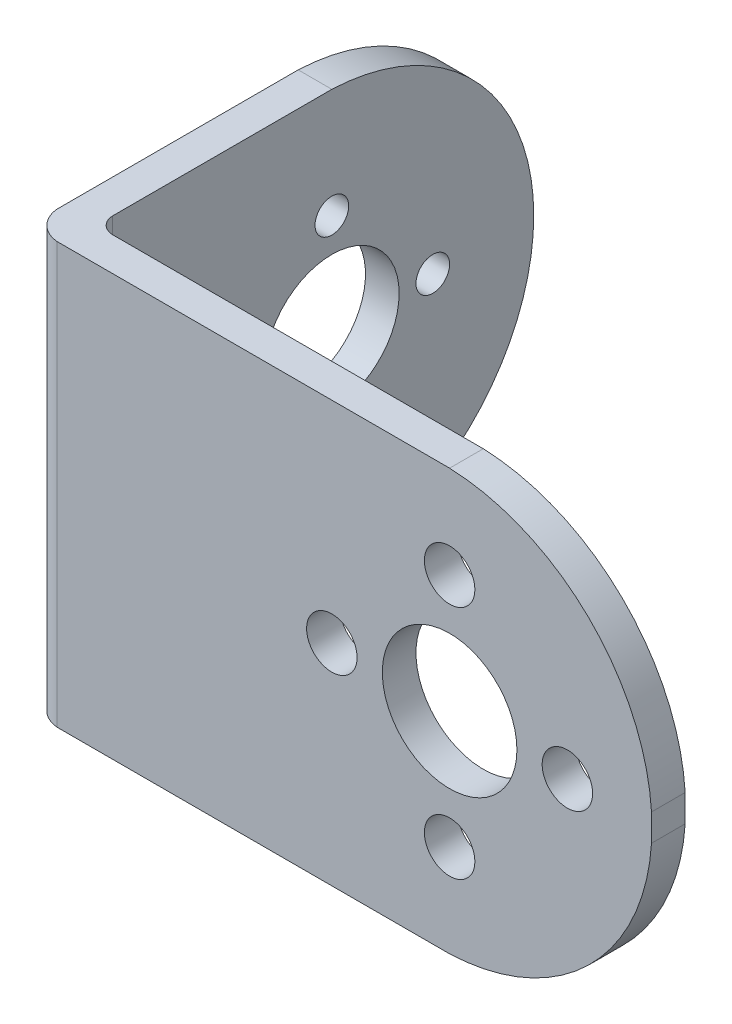
from build123d import *

# Parameters (mm, degrees)
BOSS_EXTRUDE1_DEPTH = 25
CUT_EXTRUDE1_DEPTH  = 25
CUT_EXTRUDE2_DEPTH  = 25
SKETCH5_R           = 4
SKETCH5_R_2         = 1.5
CUT_EXTRUDE3_DEPTH  = 25
SKETCH6_R           = 4
SKETCH6_R_2         = 1
CUT_EXTRUDE4_DEPTH  = 25


with BuildPart() as part:
    # Sketch1 → Boss-Extrude1 (new body)
    with BuildSketch(Plane(origin=(0, 0, 0), x_dir=(1, 0, 0), z_dir=(0, 1, 0))):
        with BuildLine():
            ThreePointArc((0, 1.659075407), (0.530256055, 0.530256055), (1.659075407, 0))
            Line((1.659075407, 0), (2, 0))
            Line((2, 0), (37, 0))
            Line((37, 0), (37, 2))
            Line((37, 2), (3.038729714, 2))
            ThreePointArc((3.038729714, 2), (3.003147911, 1.999369152), (2.967566108, 2))
            ThreePointArc((2.967566108, 2), (2.293369144, 2.293369144), (2, 2.967566108))
            Line((2, 2.967566108), (2, 28))
            Line((2, 28), (0, 28))
            Line((0, 28), (0, 2))
            Line((0, 2), (0, 1.659075407))
        make_face()
    extrude(amount=BOSS_EXTRUDE1_DEPTH)

    # Sketch2 → Cut-Extrude1 (cut)
    with BuildSketch(Plane.ZY):
        with BuildLine():
            ThreePointArc((-28, 12.5), (-24.514439297, 21.163861726), (-16, 25))
            Line((-16, 25), (-28, 25))
            Line((-28, 25), (-28, 12.5))
        make_face()
        with BuildLine():
            ThreePointArc((-16, 0), (-24.514439297, 3.836138274), (-28, 12.5))
            Line((-28, 12.5), (-28, 0))
            Line((-28, 0), (-16, 0))
        make_face()
    extrude(amount=-CUT_EXTRUDE1_DEPTH, mode=Mode.SUBTRACT)

    # Sketch4 → Cut-Extrude2 (cut)
    with BuildSketch(Plane.XY):
        with BuildLine():
            Line((37, 25), (25, 25))
            ThreePointArc((25, 25), (33.247279652, 21.458751494), (37, 13.305521912))
            Line((37, 13.305521912), (37, 25))
        make_face()
        with BuildLine():
            Line((37, 0), (37, 11.694478088))
            ThreePointArc((37, 11.694478088), (33.247279652, 3.541248506), (25, 0))
            Line((25, 0), (37, 0))
        make_face()
    extrude(amount=-CUT_EXTRUDE2_DEPTH, mode=Mode.SUBTRACT)

    # Sketch5 → Cut-Extrude3 (cut)
    with BuildSketch(Plane.XY):
        with Locations((25, 12.5)):
            Circle(SKETCH5_R)
        with Locations((25, 19.5)):
            Circle(SKETCH5_R_2)
        with Locations((32, 12.5)):
            Circle(SKETCH5_R_2)
        with Locations((25, 5.5)):
            Circle(SKETCH5_R_2)
        with Locations((18, 12.5)):
            Circle(SKETCH5_R_2)
    extrude(amount=-CUT_EXTRUDE3_DEPTH, mode=Mode.SUBTRACT)

    # Sketch6 → Cut-Extrude4 (cut)
    with BuildSketch(Plane.ZY):
        with Locations((-16, 12.5)):
            Circle(SKETCH6_R)
        with Locations((-16, 18.5)):
            Circle(SKETCH6_R_2)
        with Locations((-10, 12.5)):
            Circle(SKETCH6_R_2)
        with Locations((-16, 6.5)):
            Circle(SKETCH6_R_2)
        with Locations((-22, 12.5)):
            Circle(SKETCH6_R_2)
    extrude(amount=-CUT_EXTRUDE4_DEPTH, mode=Mode.SUBTRACT)


solid = part.part
